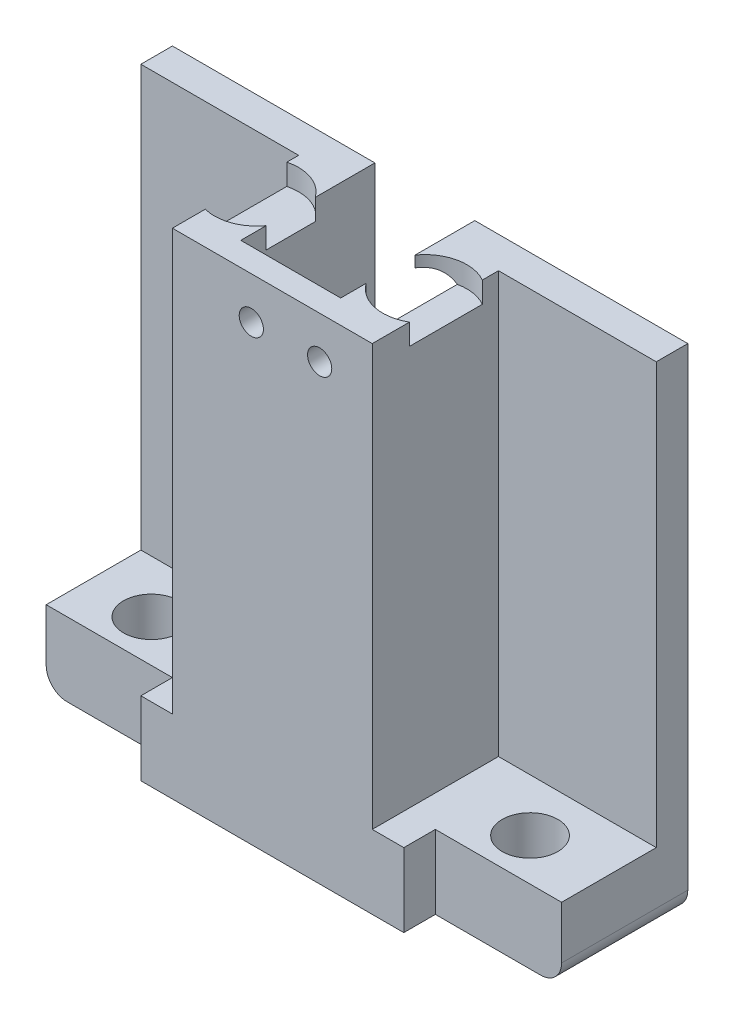
from build123d import *

# Parameters (mm, degrees)
SKETCH_1_W           = 55
SKETCH_1_H           = 53
EXTRUDE_1_DEPTH      = 16
SKETCH_3_R           = 2.65
CUT_EXTRUDE_2_DEPTH  = 79.038452061
SKETCH_4_W           = 9.5
SKETCH_4_H           = 12.75
CUT_EXTRUDE_3_DEPTH  = 79.038452061
SKETCH_2_W           = 12
SKETCH_2_H           = 53
CUT_EXTRUDE_4_DEPTH  = 4
SKETCH_5_W           = 12
SKETCH_5_H           = 46
CUT_EXTRUDE_5_DEPTH  = 9
FILLET_1_R           = 2
CUT_EXTRUDE_6_DEPTH  = 79.038452061
FILLET_2_R           = 2
SKETCH_12_W          = 55.94515333
SKETCH_12_H          = 33.208956196
CUT_EXTRUDE_10_DEPTH = 6
SKETCH_13_R          = 1.15
CUT_EXTRUDE_11_DEPTH = 70.756720106
SKETCH_11_W          = 3
SKETCH_11_H          = 46
CUT_EXTRUDE_9_DEPTH  = 13
CUT_EXTRUDE_12_DEPTH = 1
SKETCH_15_R          = 3
SKETCH_15_R_2        = 2.95
CUT_EXTRUDE_13_DEPTH = 12.75
SKETCH_16_R          = 4
CUT_EXTRUDE_14_DEPTH = 2


with BuildPart() as part:
    # 草图1 → 凸台-拉伸1 (new body)
    with BuildSketch(Plane.XY):
        with Locations((-27.5, 26.5)):
            Rectangle(SKETCH_1_W, SKETCH_1_H)
    extrude(amount=EXTRUDE_1_DEPTH)

    # 草图3 → 切除-拉伸2 (cut, through all)
    with BuildSketch(Plane.XZ):
        with Locations(Location((-43, 8, 0), (0, 0, 270))):
            Circle(SKETCH_3_R)
        with Locations(Location((-7, 8, 0), (0, 0, 270))):
            Circle(SKETCH_3_R)
    extrude(amount=-CUT_EXTRUDE_2_DEPTH, mode=Mode.SUBTRACT)

    # 草图4 → 切除-拉伸3 (cut, through all)
    with BuildSketch(Plane.XZ):
        with Locations((-25, 6.375)):
            Rectangle(SKETCH_4_W, SKETCH_4_H)
    extrude(amount=-CUT_EXTRUDE_3_DEPTH, mode=Mode.SUBTRACT)

    # 草图2 → 切除-拉伸4 (cut)
    with BuildSketch(Plane.XY.offset(16)):
        with Locations((-43, 26.5)):
            Rectangle(SKETCH_2_W, SKETCH_2_H)
        with Locations((-6, 26.5)):
            Rectangle(SKETCH_2_W, SKETCH_2_H)
    extrude(amount=-CUT_EXTRUDE_4_DEPTH, mode=Mode.SUBTRACT)

    # 草图5 → 切除-拉伸5 (cut)
    with BuildSketch(Plane.XY.offset(12)):
        with Locations((-43, 30)):
            Rectangle(SKETCH_5_W, SKETCH_5_H)
        with Locations((-6, 30)):
            Rectangle(SKETCH_5_W, SKETCH_5_H)
    extrude(amount=-CUT_EXTRUDE_5_DEPTH, mode=Mode.SUBTRACT)

    # 圆角1
    fillet_1_edges = [part.edges().sort_by_distance(p)[0] for p in [
        (0, 0, 6),
        (0, 53, 1.5),
        (-55, 53, 8),
        (-55, 0, 8),
    ]]
    fillet(fillet_1_edges, radius=FILLET_1_R)

    # 草图6 → 切除-拉伸6 (cut, through all)
    with BuildSketch(Plane.XY.offset(16)):
        with BuildLine():
            Line((-49, 0), (-49, 53))
            Line((-49, 53), (-53, 53))
            ThreePointArc((-53, 53), (-54.414213562, 52.414213562), (-55, 51))
            Line((-55, 51), (-55, 2))
            ThreePointArc((-55, 2), (-54.414213562, 0.585786438), (-53, 0))
            Line((-53, 0), (-49, 0))
        make_face()
    extrude(amount=-CUT_EXTRUDE_6_DEPTH, mode=Mode.SUBTRACT)

    # 圆角2
    fillet_2_edges = [part.edges().sort_by_distance(p)[0] for p in [
        (-49, 53, 1.5),
        (-49, 0, 6),
    ]]
    fillet(fillet_2_edges, radius=FILLET_2_R)

    # 草图12 → 切除-拉伸10 (cut)
    with BuildSketch(Plane(origin=(0, 53, 0), x_dir=(1, 0, 0), z_dir=(0, 1, 0))):
        with Locations((-25.829443508, -5.558164986)):
            Rectangle(SKETCH_12_W, SKETCH_12_H)
    extrude(amount=-CUT_EXTRUDE_10_DEPTH, mode=Mode.SUBTRACT)

    # 草图13 → 切除-拉伸11 (cut, through all)
    with BuildSketch(Plane.XY.offset(16)):
        with Locations((-26.5, 43)):
            Circle(SKETCH_13_R)
        with Locations((-20, 43)):
            Circle(SKETCH_13_R)
    extrude(amount=-CUT_EXTRUDE_11_DEPTH, mode=Mode.SUBTRACT)

    # 草图11 → 切除-拉伸9 (cut)
    with BuildSketch(Plane.XY.offset(16)):
        with Locations((-35.5, 30)):
            Rectangle(SKETCH_11_W, SKETCH_11_H)
        with Locations((-13.5, 30)):
            Rectangle(SKETCH_11_W, SKETCH_11_H)
    extrude(amount=-CUT_EXTRUDE_9_DEPTH, mode=Mode.SUBTRACT)

    # 草图14 → 切除-拉伸12 (cut)
    with BuildSketch(Plane.XY.offset(16)):
        Polygon((-34, 47), (-34, 7), (-37, 7), (-37, 0), (-12, 0), (-12, 7), (-15, 7), (-15, 47), align=None)
    extrude(amount=-CUT_EXTRUDE_12_DEPTH, mode=Mode.SUBTRACT)

    # 草图15 → 切除-拉伸13 (cut)
    with BuildSketch(Plane(origin=(0, 0, 0), x_dir=(-1, 0, 0), z_dir=(0, 0, -1))):
        with Locations((26.5, 43)):
            Circle(SKETCH_15_R)
        with Locations((20, 43)):
            Circle(SKETCH_15_R_2)
    extrude(amount=-CUT_EXTRUDE_13_DEPTH, mode=Mode.SUBTRACT)

    # 草图16 → 切除-拉伸14 (cut)
    with BuildSketch(Plane(origin=(0, 47, 0), x_dir=(1, 0, 0), z_dir=(0, 1, 0))):
        with Locations((-17, -8)):
            Circle(SKETCH_16_R)
        with Locations((-33, -8)):
            Circle(SKETCH_16_R)
    extrude(amount=-CUT_EXTRUDE_14_DEPTH, mode=Mode.SUBTRACT)


solid = part.part
